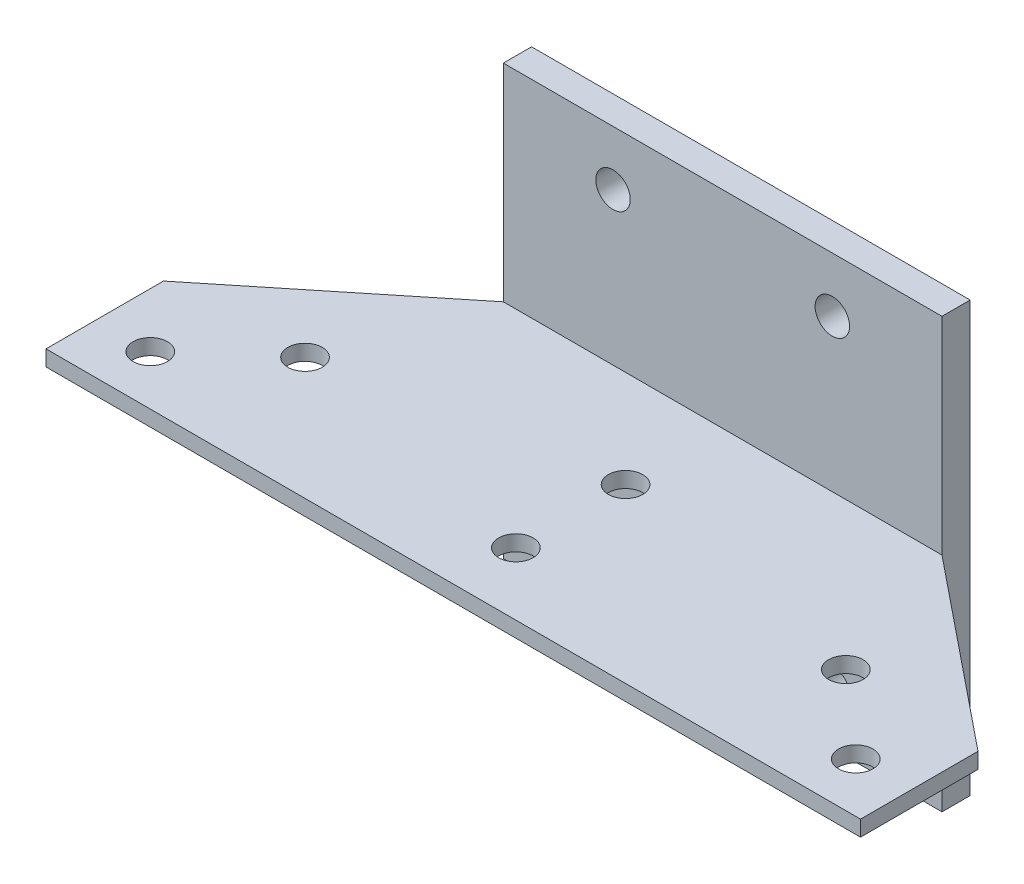
from build123d import *

# Parameters (mm, degrees)
SKETCH_1_W          = 280
SKETCH_1_H          = 274
EXTRUDE_1_DEPTH     = 18
SKETCH_2_W          = 520
SKETCH_2_H          = 10
EXTRUDE_2_DEPTH     = 172
CUT_EXTRUDE_1_DEPTH = 466.041933593
CUT_EXTRUDE_2_DEPTH = 466.041933593
SKETCH_5_R          = 11
CUT_EXTRUDE_3_DEPTH = 521.745619281
SKETCH_6_R          = 11
CUT_EXTRUDE_4_DEPTH = 521.745619281
SKETCH_7_R          = 11
CUT_EXTRUDE_5_DEPTH = 521.745619281
SKETCH_8_R          = 11
CUT_EXTRUDE_6_DEPTH = 521.745619281
SKETCH_9_R          = 11
CUT_EXTRUDE_8_DEPTH = 466.041933593


with BuildPart() as part:
    # 草图1 → 拉伸1 (new body)
    with BuildSketch(Plane.XY):
        with Locations((140, 137)):
            Rectangle(SKETCH_1_W, SKETCH_1_H)
    extrude(amount=EXTRUDE_1_DEPTH)

    # 草图2 → 拉伸2 (add)
    with BuildSketch(Plane.XY.offset(18)):
        with Locations((140, 137)):
            Rectangle(SKETCH_2_W, SKETCH_2_H)
    extrude(amount=EXTRUDE_2_DEPTH)

    # 草图3 → 切除-拉伸1 (cut, through all)
    with BuildSketch(Plane.XZ.offset(-132)):
        Polygon((0, 18), (-120, 115), (-120, 18), align=None)
    extrude(amount=-CUT_EXTRUDE_1_DEPTH, mode=Mode.SUBTRACT)

    # 草图4 → 切除-拉伸2 (cut, through all)
    with BuildSketch(Plane.XZ.offset(-132)):
        Polygon((400, 115), (280, 18), (400, 18), align=None)
    extrude(amount=-CUT_EXTRUDE_2_DEPTH, mode=Mode.SUBTRACT)

    # 草图5 → 切除-拉伸3 (cut, through all)
    with BuildSketch(Plane(origin=(0, 0, 0), x_dir=(-1, 0, 0), z_dir=(0, 0, -1))):
        with Locations((-210, 35)):
            Circle(SKETCH_5_R)
    extrude(amount=-CUT_EXTRUDE_3_DEPTH, mode=Mode.SUBTRACT)

    # 草图6 → 切除-拉伸4 (cut, through all)
    with BuildSketch(Plane(origin=(0, 0, 0), x_dir=(-1, 0, 0), z_dir=(0, 0, -1))):
        with Locations((-210, 239)):
            Circle(SKETCH_6_R)
    extrude(amount=-CUT_EXTRUDE_4_DEPTH, mode=Mode.SUBTRACT)

    # 草图7 → 切除-拉伸5 (cut, through all)
    with BuildSketch(Plane(origin=(0, 0, 0), x_dir=(-1, 0, 0), z_dir=(0, 0, -1))):
        with Locations((-70, 35)):
            Circle(SKETCH_7_R)
    extrude(amount=-CUT_EXTRUDE_5_DEPTH, mode=Mode.SUBTRACT)

    # 草图8 → 切除-拉伸6 (cut, through all)
    with BuildSketch(Plane(origin=(0, 0, 0), x_dir=(-1, 0, 0), z_dir=(0, 0, -1))):
        with Locations((-70, 239)):
            Circle(SKETCH_8_R)
    extrude(amount=-CUT_EXTRUDE_6_DEPTH, mode=Mode.SUBTRACT)

    # 草图9 → 切除-拉伸8 (cut, through all)
    with BuildSketch(Plane.XZ.offset(-132)):
        with Locations((140, 80)):
            Circle(SKETCH_9_R)
        with Locations((140, 150)):
            Circle(SKETCH_9_R)
        with Locations((-85.189055636, 158.241096139)):
            Circle(SKETCH_9_R)
        with Locations((-32.636595866, 112)):
            Circle(SKETCH_9_R)
        with Locations((365.189055636, 158.241096139)):
            Circle(SKETCH_9_R)
        with Locations((312.636595866, 112)):
            Circle(SKETCH_9_R)
    extrude(amount=-CUT_EXTRUDE_8_DEPTH, mode=Mode.SUBTRACT)


solid = part.part
